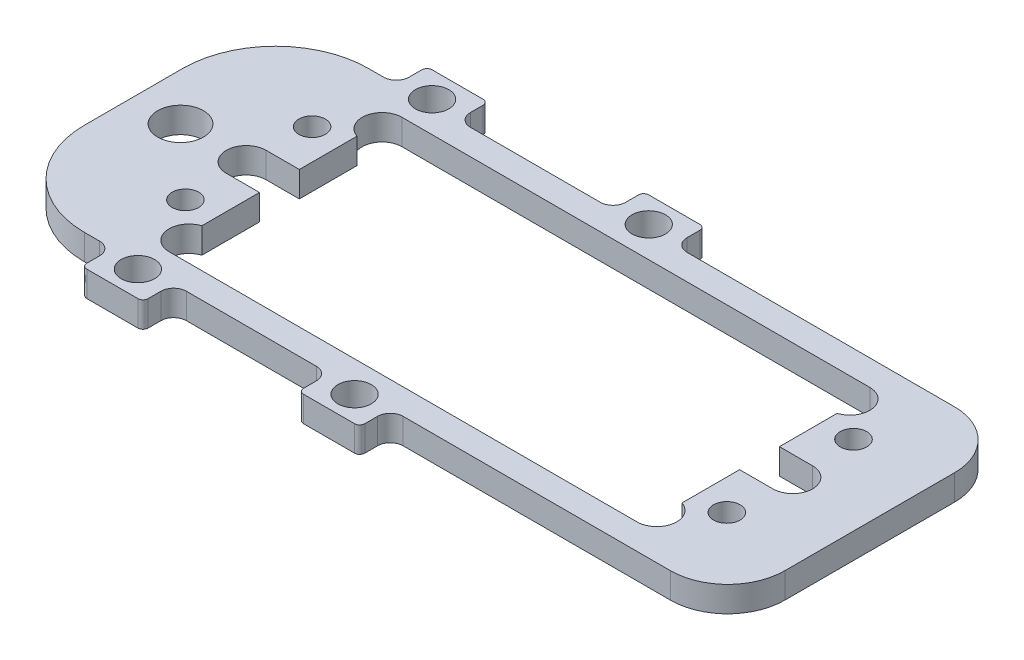
from build123d import *

# Parameters (mm, degrees)
CROQUIS1_R              = 1.35255
CROQUIS1_R_2            = 1.778
SALIENTE_EXTRUIR1_DEPTH = 3.175
CROQUIS5_R              = 2.55
CORTAR_EXTRUIR1_DEPTH   = 53.649355209
CROQUIS6_R              = 2.078
CROQUIS6_R_2            = 1.65255
CROQUIS6_R_3            = 2.85
CORTAR_EXTRUIR2_DEPTH   = 53.649355209


with BuildPart() as part:
    # Croquis1 → Saliente-Extruir1 (new body)
    with BuildSketch(Plane.XZ):
        with BuildLine():
            Line((-6.02234, -19.2405), (-6.02234, -20.828))
            ThreePointArc((-6.02234, -20.828), (-5.836352806, -21.277012806), (-5.38734, -21.463))
            Line((-5.38734, -21.463), (0.96266, -21.463))
            ThreePointArc((0.96266, -21.463), (1.411672806, -21.277012806), (1.59766, -20.828))
            Line((1.59766, -20.828), (1.59766, -19.2405))
            ThreePointArc((1.59766, -19.2405), (2.062627985, -18.117967985), (3.18516, -17.653))
            Line((3.18516, -17.653), (36.43122, -17.653))
            ThreePointArc((36.43122, -17.653), (41.454190356, -15.572417555), (43.534772801, -10.549447199))
            Line((43.534772801, -10.549447199), (43.534772801, 10.549447199))
            ThreePointArc((43.534772801, 10.549447199), (41.454190356, 15.572417555), (36.43122, 17.653))
            Line((36.43122, 17.653), (3.18516, 17.653))
            ThreePointArc((3.18516, 17.653), (2.062627985, 18.117967985), (1.59766, 19.2405))
            Line((1.59766, 19.2405), (1.59766, 20.828))
            ThreePointArc((1.59766, 20.828), (1.411672806, 21.277012806), (0.96266, 21.463))
            Line((0.96266, 21.463), (-5.38734, 21.463))
            ThreePointArc((-5.38734, 21.463), (-5.836352806, 21.277012806), (-6.02234, 20.828))
            Line((-6.02234, 20.828), (-6.02234, 19.2405))
            ThreePointArc((-6.02234, 19.2405), (-6.487307985, 18.117967985), (-7.60984, 17.653))
            Line((-7.60984, 17.653), (-23.755604, 17.653))
            ThreePointArc((-23.755604, 17.653), (-24.878136015, 18.117967985), (-25.343104, 19.2405))
            Line((-25.343104, 19.2405), (-25.343104, 20.828))
            ThreePointArc((-25.343104, 20.828), (-25.529091194, 21.277012806), (-25.978104, 21.463))
            Line((-25.978104, 21.463), (-32.328104, 21.463))
            ThreePointArc((-32.328104, 21.463), (-32.777116806, 21.277012806), (-32.963104, 20.828))
            Line((-32.963104, 20.828), (-32.963104, 19.2405))
            ThreePointArc((-32.963104, 19.2405), (-33.428071985, 18.117967985), (-34.550604, 17.653))
            Line((-34.550604, 17.653), (-36.43122, 17.653))
            ThreePointArc((-36.43122, 17.653), (-44.591052878, 14.273086555), (-47.970966323, 6.113253677))
            Line((-47.970966323, 6.113253677), (-47.970966323, -6.113253677))
            ThreePointArc((-47.970966323, -6.113253677), (-44.591052878, -14.273086555), (-36.43122, -17.653))
            Line((-36.43122, -17.653), (-34.550604, -17.653))
            ThreePointArc((-34.550604, -17.653), (-33.428071985, -18.117967985), (-32.963104, -19.2405))
            Line((-32.963104, -19.2405), (-32.963104, -20.828))
            ThreePointArc((-32.963104, -20.828), (-32.777116806, -21.277012806), (-32.328104, -21.463))
            Line((-32.328104, -21.463), (-25.978104, -21.463))
            ThreePointArc((-25.978104, -21.463), (-25.529091194, -21.277012806), (-25.343104, -20.828))
            Line((-25.343104, -20.828), (-25.343104, -19.2405))
            ThreePointArc((-25.343104, -19.2405), (-24.878136015, -18.117967985), (-23.755604, -17.653))
            Line((-23.755604, -17.653), (-7.60984, -17.653))
            ThreePointArc((-7.60984, -17.653), (-6.487307985, -18.117967985), (-6.02234, -19.2405))
        make_face()
        with Locations(Location((33.655, -7.874, 0), (0, 0, 90))):
            Circle(CROQUIS1_R, mode=Mode.SUBTRACT)
        with Locations(Location((-33.655, 7.874, 0), (0, 0, 90))):
            Circle(CROQUIS1_R, mode=Mode.SUBTRACT)
        with Locations(Location((-33.655, -7.874, 0), (0, 0, 90))):
            Circle(CROQUIS1_R, mode=Mode.SUBTRACT)
        with Locations(Location((-2.21234, 18.288, 0), (0, 0, 90))):
            Circle(CROQUIS1_R_2, mode=Mode.SUBTRACT)
        with Locations(Location((-29.153104, -18.288, 0), (0, 0, 90))):
            Circle(CROQUIS1_R_2, mode=Mode.SUBTRACT)
        with Locations(Location((-2.21234, -18.288, 0), (0, 0, 90))):
            Circle(CROQUIS1_R_2, mode=Mode.SUBTRACT)
        with Locations(Location((-29.153104, 18.288, 0), (0, 0, 90))):
            Circle(CROQUIS1_R_2, mode=Mode.SUBTRACT)
        with Locations(Location((33.655, 7.874, 0), (0, 0, 90))):
            Circle(CROQUIS1_R, mode=Mode.SUBTRACT)
        with BuildLine():
            Line((-33.9725, 2.4765), (-29.845, 2.4765))
            Line((-29.845, 2.4765), (-29.845, 9.645968035))
            ThreePointArc((-29.845, 9.645968035), (-31.52653105, 12.388525412), (-29.08046, 14.478))
            Line((-29.08046, 14.478), (29.08046, 14.478))
            ThreePointArc((29.08046, 14.478), (31.52653105, 12.388525412), (29.845, 9.645968035))
            Line((29.845, 9.645968035), (29.845, 2.4765))
            Line((29.845, 2.4765), (33.9725, 2.4765))
            ThreePointArc((33.9725, 2.4765), (36.449, 0), (33.9725, -2.4765))
            Line((33.9725, -2.4765), (29.845, -2.4765))
            Line((29.845, -2.4765), (29.845, -9.645968035))
            ThreePointArc((29.845, -9.645968035), (31.52653105, -12.388525412), (29.08046, -14.478))
            Line((29.08046, -14.478), (-29.08046, -14.478))
            ThreePointArc((-29.08046, -14.478), (-31.52653105, -12.388525412), (-29.845, -9.645968035))
            Line((-29.845, -9.645968035), (-29.845, -2.4765))
            Line((-29.845, -2.4765), (-33.9725, -2.4765))
            ThreePointArc((-33.9725, -2.4765), (-36.449, 0), (-33.9725, 2.4765))
        make_face(mode=Mode.SUBTRACT)
    extrude(amount=-SALIENTE_EXTRUIR1_DEPTH)

    # Croquis5 → Cortar-Extruir1 (cut, through all)
    with BuildSketch(Plane(origin=(0, 3.175, 0), x_dir=(1, 0, 0), z_dir=(0, 1, 0))):
        with Locations(Location((-42.138904379, 0, 0), (0, 0, 270))):
            Circle(CROQUIS5_R)
    extrude(amount=-CORTAR_EXTRUIR1_DEPTH, mode=Mode.SUBTRACT)

    # Croquis6 → Cortar-Extruir2 (cut, through all)
    with BuildSketch(Plane(origin=(0, 3.175, 0), x_dir=(1, 0, 0), z_dir=(0, 1, 0))):
        with Locations(Location((-29.153104, 18.288, 0), (0, 0, 270))):
            Circle(CROQUIS6_R)
        with Locations(Location((-33.655, 7.874, 0), (0, 0, 270))):
            Circle(CROQUIS6_R_2)
        with Locations(Location((-33.655, -7.874, 0), (0, 0, 270))):
            Circle(CROQUIS6_R_2)
        with Locations(Location((-29.153104, -18.288, 0), (0, 0, 270))):
            Circle(CROQUIS6_R)
        with Locations(Location((-2.21234, -18.288, 0), (0, 0, 270))):
            Circle(CROQUIS6_R)
        with Locations(Location((-42.138904379, 0, 0), (0, 0, 270))):
            Circle(CROQUIS6_R_3)
        with Locations(Location((-2.21234, 18.288, 0), (0, 0, 270))):
            Circle(CROQUIS6_R)
        with Locations(Location((33.655, 7.874, 0), (0, 0, 270))):
            Circle(CROQUIS6_R_2)
        with Locations(Location((33.655, -7.874, 0), (0, 0, 270))):
            Circle(CROQUIS6_R_2)
    extrude(amount=-CORTAR_EXTRUIR2_DEPTH, mode=Mode.SUBTRACT)


solid = part.part
